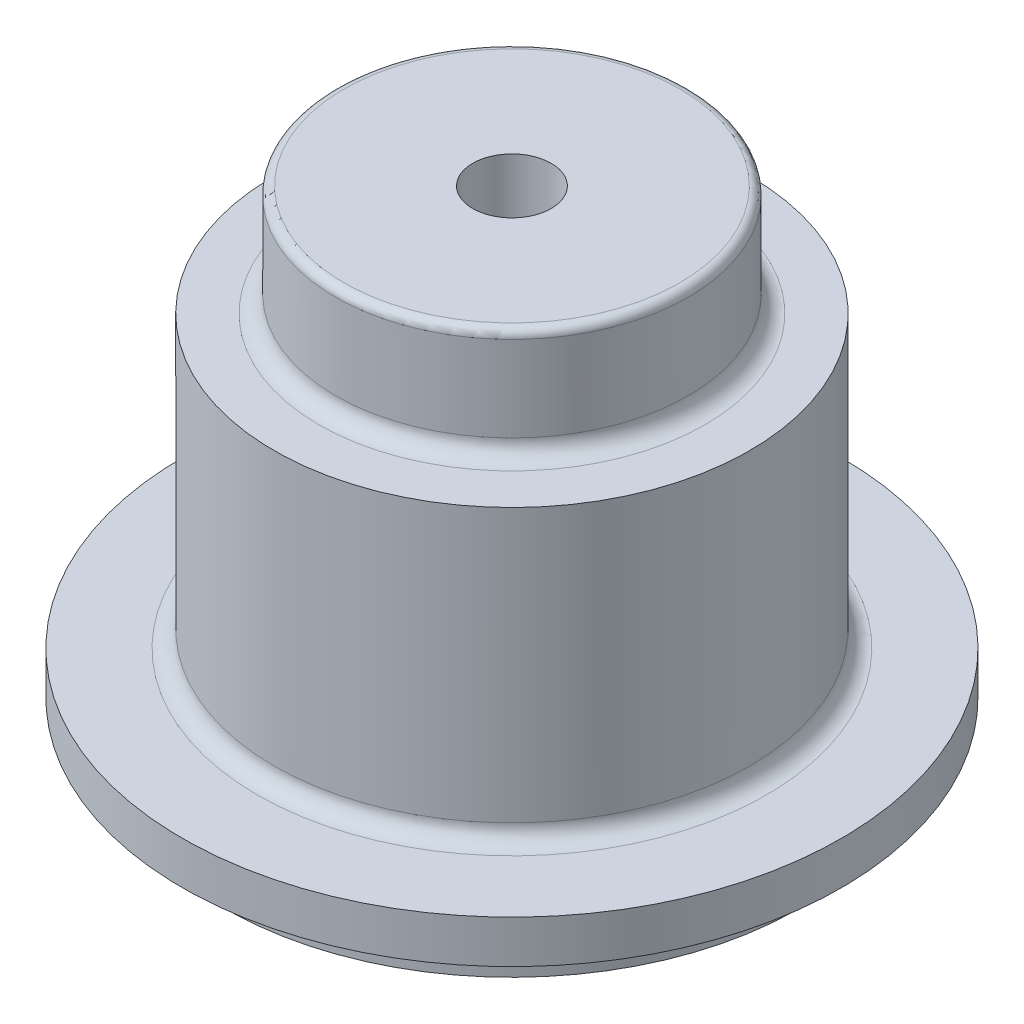
from build123d import *

# Parameters (mm, degrees)
FILLET2_R = 1.27
FILLET3_R = 0.635


with BuildPart() as part:
    # Sketch1 → Revolve4 (revolve)
    with BuildSketch(Plane.XY, mode=Mode.PRIVATE) as revolve4_sk:
        Polygon((12.334639896, 0), (21.75, 0), (21.75, 3), (25, 3), (25, 6.25), (18.035610483, 6.25), (18.035610483, 28.23587128), (13.370385965, 28.23587128), (13.370385965, 36.611095198), (2.974741934, 36.611095198), (2.974741934, 28.23587128), (0, 28.23587128), (0, 25.3), (2.830568931, 25.3), (2.974741934, 25.3), (12.334639896, 25.3), align=None)
    revolve(revolve4_sk.sketch.rotate(Axis((0, 0, 0), (0, 1, 0)), 90), axis=Axis((0, 0, 0), (0, 1, 0)))

    # Fillet2
    fillet2_edges = [part.edges().sort_by_distance(p)[0] for p in [
        (0, 28.23587128, 13.370385965),
        (0, 6.25, 18.035610483),
    ]]
    fillet(fillet2_edges, radius=FILLET2_R)

    # Fillet3
    fillet3_edges = [part.edges().sort_by_distance(p)[0] for p in [
        (0, 36.611095198, 13.370385965),
    ]]
    fillet(fillet3_edges, radius=FILLET3_R)


solid = part.part
